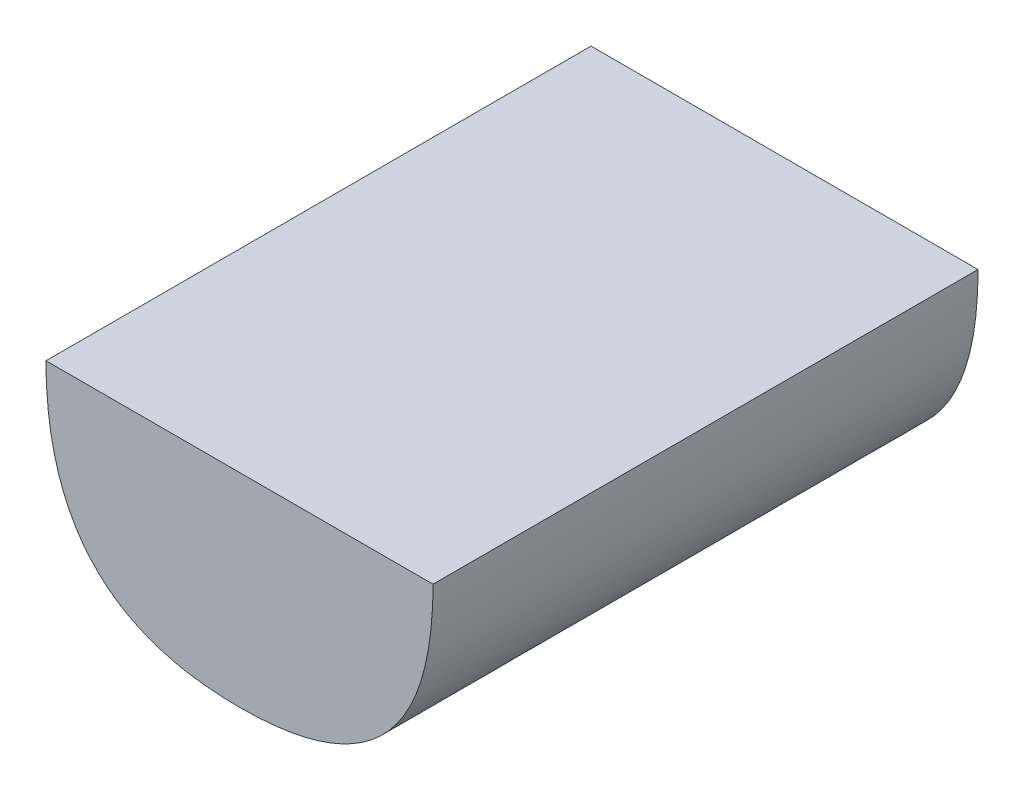
from build123d import *

# Parameters (mm, degrees)
BOSS_EXTRUDE1_DEPTH = 851.662


with BuildPart() as part:
    # Sketch1 → Boss-Extrude1 (new body)
    with BuildSketch(Plane.XY):
        with BuildLine():
            Line((-302.357037841, 317.813001305), (302.357037841, 317.813001305))
            add(Edge.make_bspline(
                [(0, 0), (302.357037841, -0.066445002), (302.357037841, 317.813001305)],
                knots=[0, 0, 0, 1, 1, 1], degree=2, weights=[1, 1.019369595, 1]))
            add(Edge.make_bspline(
                [(0, 0), (-302.357037841, -0.066445002), (-302.357037841, 317.813001305)],
                knots=[0, 0, 0, 1, 1, 1], degree=2, weights=[1, 1.019369595, 1]))
        make_face()
    extrude(amount=-BOSS_EXTRUDE1_DEPTH)


solid = part.part
